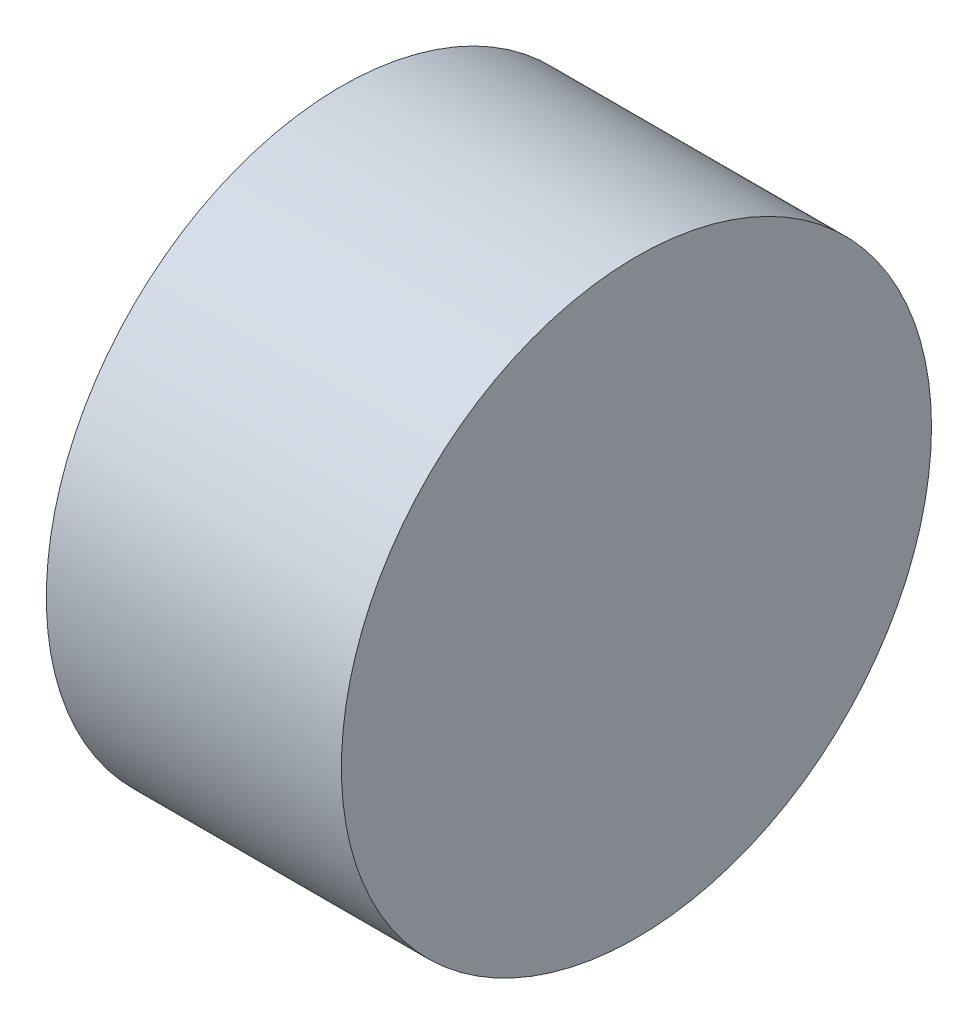
from build123d import *

# Parameters (mm, degrees)
SKETCH2_R           = 5
BOSS_EXTRUDE1_DEPTH = 5


with BuildPart() as part:
    # Sketch2 → Boss-Extrude1 (new body)
    with BuildSketch(Plane(origin=(0, 0, 0), x_dir=(0, 0, -1), z_dir=(1, 0, 0))):
        Circle(SKETCH2_R)
    extrude(amount=BOSS_EXTRUDE1_DEPTH)


solid = part.part
